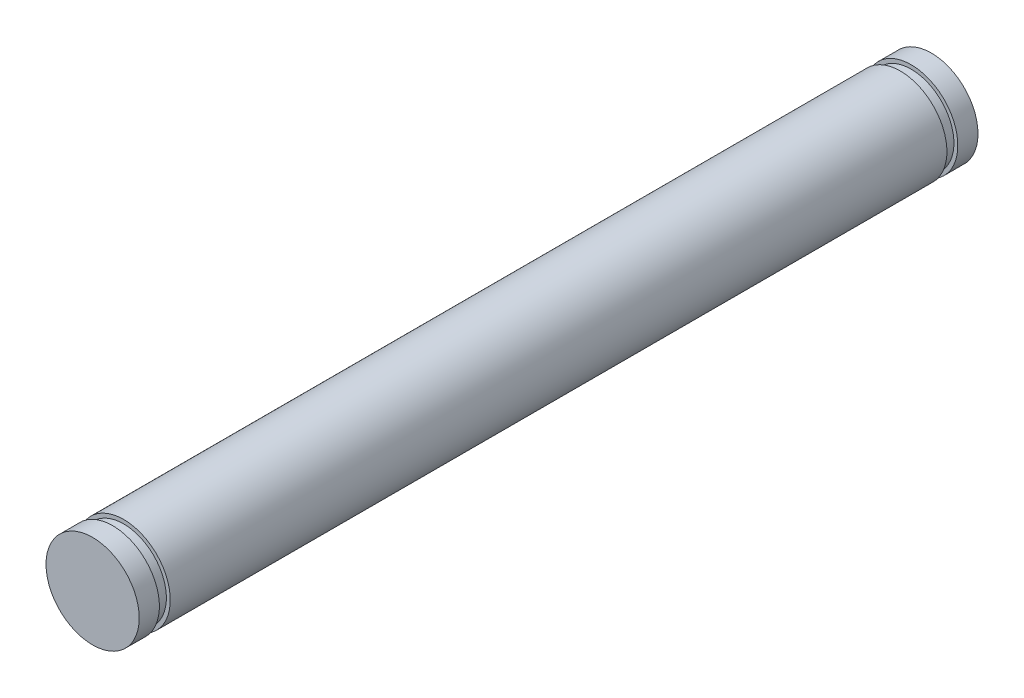
from build123d import *

# Parameters (mm, degrees)
SKETCH_1_R          = 3
EXTRUDE_1_DEPTH     = 54
SKETCH_2_R          = 3
SKETCH_2_R_2        = 2.75
CUT_EXTRUDE_1_DEPTH = 0.35


with BuildPart() as part:
    # 스케치1 → 보스-돌출1 (new body)
    with BuildSketch(Plane.XY):
        Circle(SKETCH_1_R)
    extrude(amount=EXTRUDE_1_DEPTH)

    # 스케치2 → 컷-돌출1 (cut, symmetric)
    with BuildSketch(Plane(origin=(0, 0, 1.65), x_dir=(-1, 0, 0), z_dir=(0, 0, -1))):
        Circle(SKETCH_2_R)
        Circle(SKETCH_2_R_2, mode=Mode.SUBTRACT)
    cut_extrude_1 = extrude(amount=CUT_EXTRUDE_1_DEPTH, both=True, mode=Mode.SUBTRACT)

    # 대칭 복사1: 컷-돌출1 across plane
    add(cut_extrude_1.mirror(Plane(origin=(0, 0, 27), x_dir=(1, 0, 0), z_dir=(0, 0, -1))), mode=Mode.SUBTRACT)


solid = part.part
